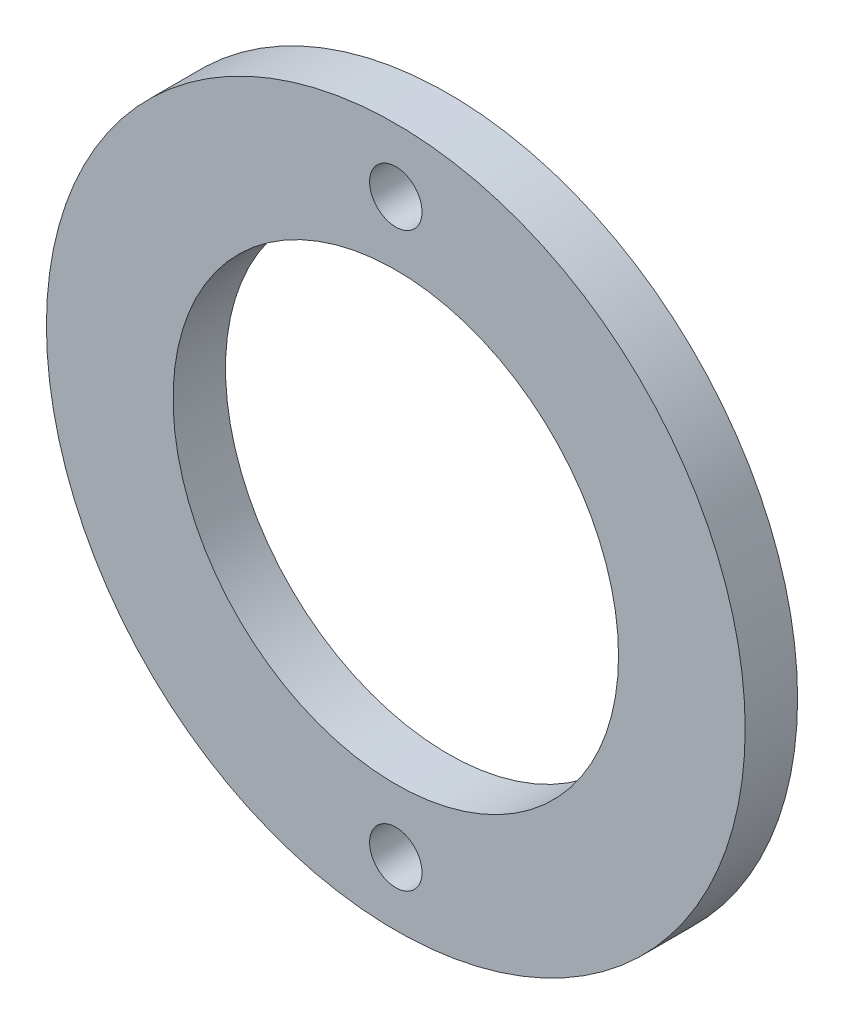
from build123d import *

# Parameters (mm, degrees)
SKETCH1_R             = 20
SKETCH1_R_2           = 12.75
BOSS_EXTRUDE1_DEPTH   = 3
F_3_0MM_DOWEL_HOLE1_D = 3


with BuildPart() as part:
    # Sketch1 → Boss-Extrude1 (new body)
    with BuildSketch(Plane.XY):
        Circle(SKETCH1_R)
        Circle(SKETCH1_R_2, mode=Mode.SUBTRACT)
    extrude(amount=BOSS_EXTRUDE1_DEPTH)

    # Ø3.0mm Dowel Hole1 (through all)
    with Locations(Plane.XY.offset(3)):
        with Locations((0, 16.375), (0, -16.375)):
            Hole(F_3_0MM_DOWEL_HOLE1_D / 2)


solid = part.part
